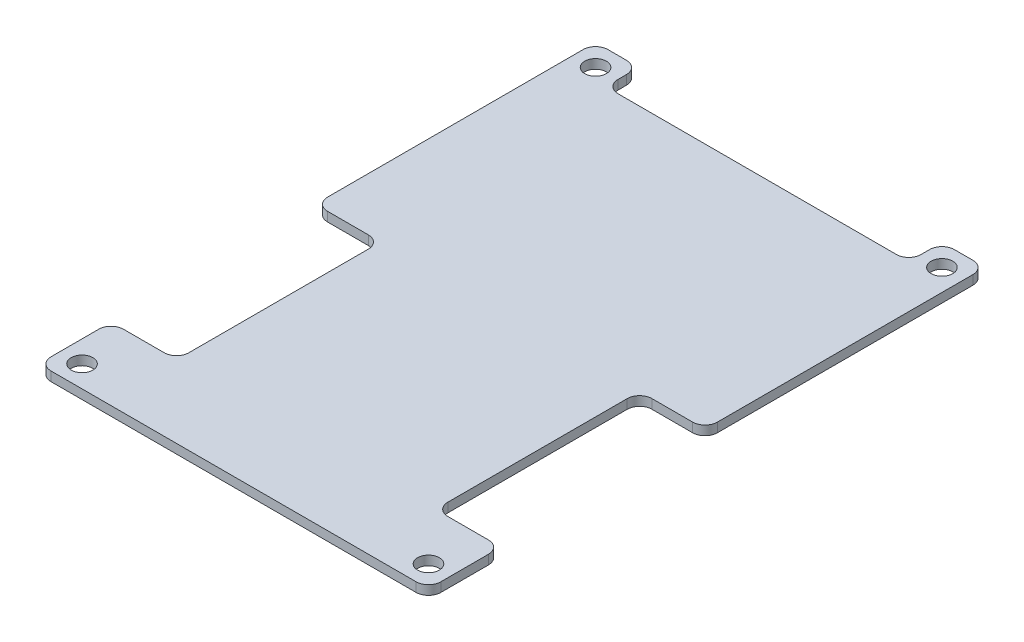
from build123d import *

# Parameters (mm, degrees)
SKETCH1_R           = 1.75
BOSS_EXTRUDE1_DEPTH = 0.75


with BuildPart() as part:
    # Sketch1 → Boss-Extrude1 (new, symmetric)
    with BuildSketch(Plane(origin=(0, 0, 0), x_dir=(1, 0, 0), z_dir=(0, 1, 0))):
        with BuildLine():
            Line((29.5, -0.3), (22.925, -0.3))
            ThreePointArc((22.925, -0.3), (21.510786438, -0.885786438), (20.925, -2.3))
            Line((20.925, -2.3), (20.925, -31.3))
            ThreePointArc((20.925, -31.3), (21.510786438, -32.714213562), (22.925, -33.3))
            Line((22.925, -33.3), (29.5, -33.3))
            ThreePointArc((29.5, -33.3), (30.914213562, -33.885786438), (31.5, -35.3))
            Line((31.5, -35.3), (31.5, -43))
            ThreePointArc((31.5, -43), (30.914213562, -44.414213562), (29.5, -45))
            Line((29.5, -45), (-29.5, -45))
            ThreePointArc((-29.5, -45), (-30.914213562, -44.414213562), (-31.5, -43))
            Line((-31.5, -43), (-31.5, -35.3))
            ThreePointArc((-31.5, -35.3), (-30.914213562, -33.885786438), (-29.5, -33.3))
            Line((-29.5, -33.3), (-22.925, -33.3))
            ThreePointArc((-22.925, -33.3), (-21.510786438, -32.714213562), (-20.925, -31.3))
            Line((-20.925, -31.3), (-20.925, -2.3))
            ThreePointArc((-20.925, -2.3), (-21.510786438, -0.885786438), (-22.925, -0.3))
            Line((-22.925, -0.3), (-29.5, -0.3))
            ThreePointArc((-29.5, -0.3), (-30.914213562, 0.285786438), (-31.5, 1.7))
            Line((-31.5, 1.7), (-31.5, 43))
            ThreePointArc((-31.5, 43), (-30.914213562, 44.414213562), (-29.5, 45))
            Line((-29.5, 45), (-26.5, 45))
            ThreePointArc((-26.5, 45), (-25.085786438, 44.414213562), (-24.5, 43))
            Line((-24.5, 43), (-24.5, 41.631016383))
            ThreePointArc((-24.5, 41.631016383), (-23.914213562, 40.216802821), (-22.5, 39.631016383))
            Line((-22.5, 39.631016383), (22.5, 39.631016383))
            ThreePointArc((22.5, 39.631016383), (23.914213562, 40.216802821), (24.5, 41.631016383))
            Line((24.5, 41.631016383), (24.5, 43))
            ThreePointArc((24.5, 43), (25.085786438, 44.414213562), (26.5, 45))
            Line((26.5, 45), (29.5, 45))
            ThreePointArc((29.5, 45), (30.914213562, 44.414213562), (31.5, 43))
            Line((31.5, 43), (31.5, 1.7))
            ThreePointArc((31.5, 1.7), (30.914213562, 0.285786438), (29.5, -0.3))
        make_face()
        with Locations(Location((27.996318987, 41.5, 0), (0, 0, 270))):
            Circle(SKETCH1_R, mode=Mode.SUBTRACT)
        with Locations(Location((-27.996318987, 41.5, 0), (0, 0, 90))):
            Circle(SKETCH1_R, mode=Mode.SUBTRACT)
        with Locations(Location((28, -41.5, 0), (0, 0, 270))):
            Circle(SKETCH1_R, mode=Mode.SUBTRACT)
        with Locations(Location((-28, -41.5, 0), (0, 0, 90))):
            Circle(SKETCH1_R, mode=Mode.SUBTRACT)
    extrude(amount=BOSS_EXTRUDE1_DEPTH, both=True)


solid = part.part
